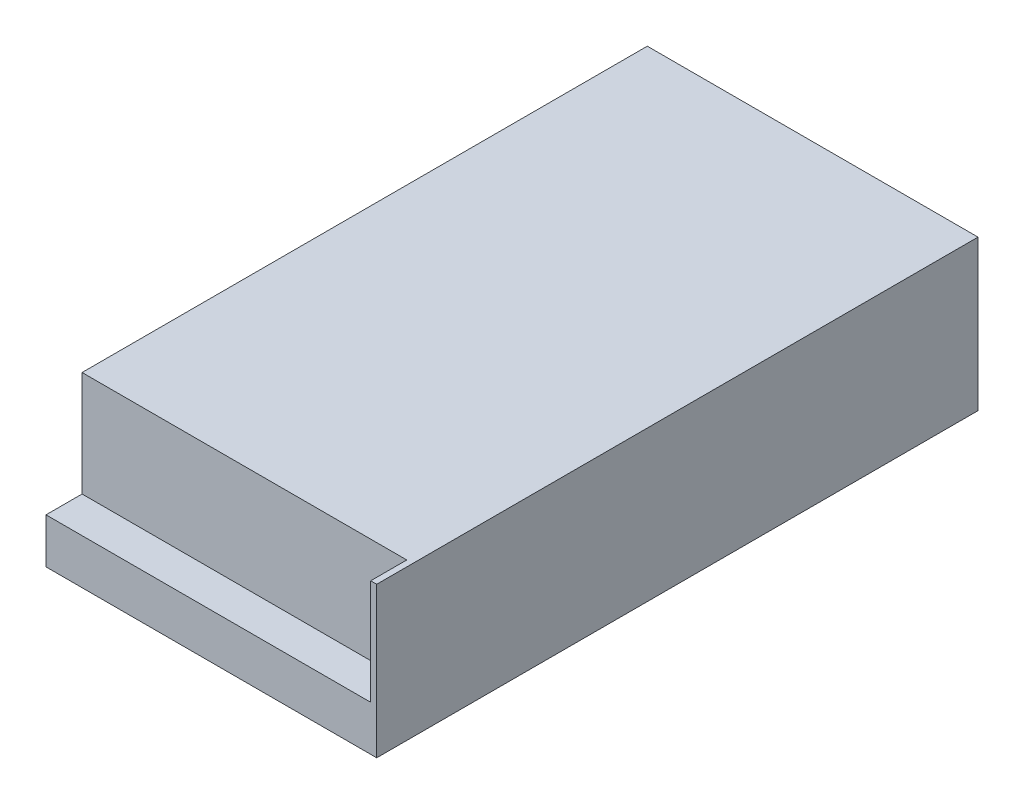
from build123d import *

# Parameters (mm, degrees)
SKETCH1_W           = 110
SKETCH1_H           = 200
BOSS_EXTRUDE1_DEPTH = 50
SKETCH2_W           = 108
SKETCH2_H           = 12
CUT_EXTRUDE1_DEPTH  = 35


with BuildPart() as part:
    # Sketch1 → Boss-Extrude1 (new body)
    with BuildSketch(Plane(origin=(0, 0, 0), x_dir=(1, 0, 0), z_dir=(0, 1, 0))):
        Rectangle(SKETCH1_W, SKETCH1_H)
    extrude(amount=BOSS_EXTRUDE1_DEPTH)

    # Sketch2 → Cut-Extrude1 (cut)
    with BuildSketch(Plane(origin=(0, 50, 0), x_dir=(1, 0, 0), z_dir=(0, 1, 0))):
        with Locations((-1, -94)):
            Rectangle(SKETCH2_W, SKETCH2_H)
    extrude(amount=-CUT_EXTRUDE1_DEPTH, mode=Mode.SUBTRACT)


solid = part.part
